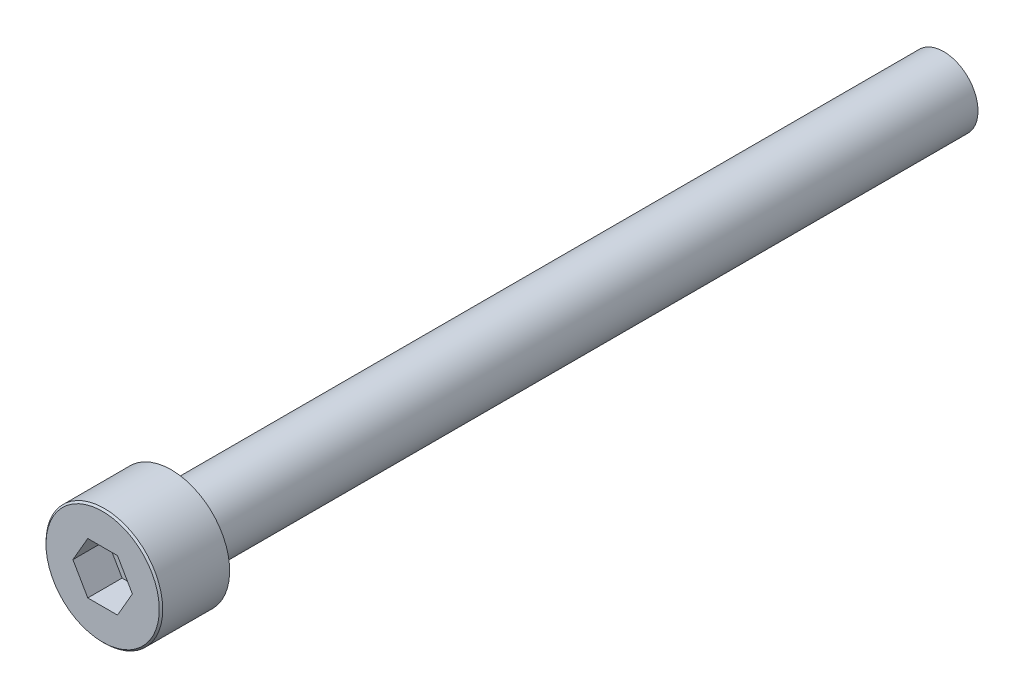
from build123d import *

# Parameters (mm, degrees)
CUT_EXTRUDE_1_DEPTH = 2
CHAMFER_631_SIZE    = 0.1


with BuildPart() as part:
    # 草图1 → 旋转1 (revolve)
    with BuildSketch(Plane(origin=(0, 0, 0), x_dir=(0, 0, -1), z_dir=(1, 0, 0))):
        Polygon((0, 0), (0, 3.4), (4, 3.4), (4, 2), (49, 2), (49, 0), align=None)
    revolve(axis=Axis((0, 0, -49), (0, 0, 1)))

    # 草图2 → 切除-拉伸1 (cut)
    with BuildSketch(Plane.XY):
        Polygon((0.866025404, 1.5), (-0.866025404, 1.5), (-1.732050808, 0), (-0.866025404, -1.5), (0.866025404, -1.5), (1.732050808, 0), align=None)
    extrude(amount=-CUT_EXTRUDE_1_DEPTH, mode=Mode.SUBTRACT)

    # Chamfer 631
    chamfer_631_edges = [part.edges().sort_by_distance(p)[0] for p in [
        (0, -3.4, 0),
    ]]
    chamfer(chamfer_631_edges, length=CHAMFER_631_SIZE)


solid = part.part
